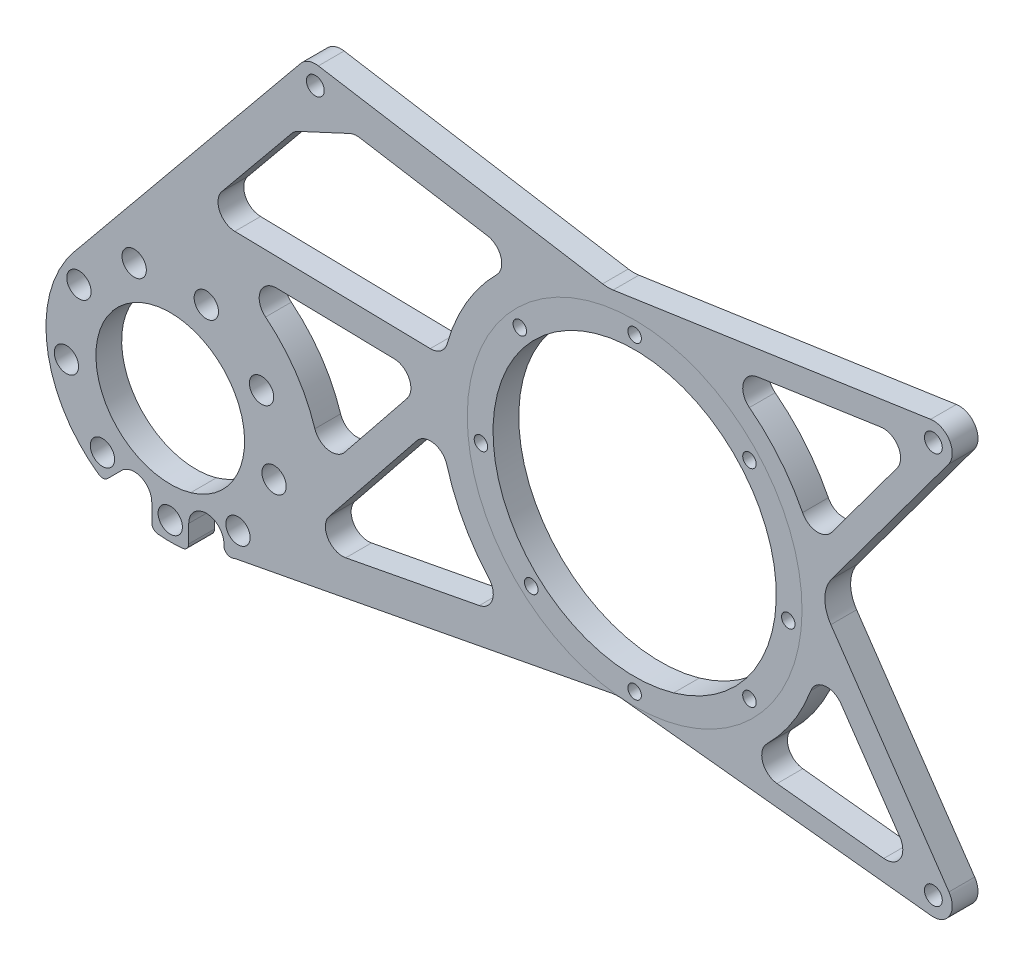
from build123d import *

# Parameters (mm, degrees)
SKETCH15_R          = 4.5
SKETCH15_R_2        = 27.4955
SKETCH15_R_3        = 2.5
SKETCH15_R_4        = 52.3875
SKETCH15_R_5        = 3.3
BOSS_EXTRUDE1_DEPTH = 9.525
PROFILE_DEPTH       = 804.13111067
PROF_FILLET_R       = 12.7
CUT_EXTRUDE2_DEPTH  = 804.13111067
FILLET2_R           = 6.35
CUT_EXTRUDE4_DEPTH  = 804.13111067
FILLET5_R           = 6.35


with BuildPart() as part:
    # Sketch15 → Boss-Extrude1 (new body)
    with BuildSketch(Plane(origin=(0, 0, 0), x_dir=(-1, 0, 0), z_dir=(0, 0, 1))):
        with BuildLine():
            ThreePointArc((-468.520845097, 164.597881552), (-470.201009111, 165.051242365), (-471.778645707, 164.316701751))
            Line((-471.778645707, 164.316701751), (-477.043529325, 159.051818133))
            ThreePointArc((-477.043529325, 159.051818133), (-484.127165713, 157.642795249), (-488.139723403, 163.648012211))
            Line((-488.139723403, 163.648012211), (-488.139723403, 170.220745001))
            ThreePointArc((-488.139723403, 170.220745001), (-488.796888696, 171.925600851), (-490.428332433, 172.748273949))
            ThreePointArc((-490.428332433, 172.748273949), (-494.978508993, 172.974), (-499.528685552, 172.748273949))
            ThreePointArc((-499.528685552, 172.748273949), (-501.160129289, 171.925600851), (-501.817294582, 170.220745001))
            Line((-501.817294582, 170.220745001), (-501.817294582, 163.648012211))
            ThreePointArc((-501.817294582, 163.648012211), (-508.317294582, 157.148012211), (-514.817294582, 163.648012211))
            Line((-514.817294582, 163.648012211), (-514.817294582, 164.225022653))
            ThreePointArc((-514.817294582, 164.225022653), (-516.106794745, 166.435870942), (-518.665995494, 166.401924563))
            Line((-518.665995494, 166.401924563), (-660.126842441, 139.458698233))
            Line((-660.126842441, 139.458698233), (-776.492771968, 151.978917225))
            ThreePointArc((-776.492771968, 151.978917225), (-781.907485254, 150.230614898), (-784.225, 145.034))
            Line((-784.225, 145.034), (-784.225, 0))
            ThreePointArc((-784.225, 0), (-782.179140867, -4.939140867), (-777.24, -6.985))
            Line((-777.24, -6.985), (-548.64, -6.985))
            ThreePointArc((-548.64, -6.985), (-545.651186694, -6.313257481), (-543.237237519, -4.427231931))
            Line((-543.237237519, -4.427231931), (-459.418508663, 97.860764379))
            ThreePointArc((-459.418508663, 97.860764379), (-449.426249212, 133.212914363), (-468.520845097, 164.597881552))
        make_face()
        with Locations((-508.317294582, 90.351987789)):
            Circle(SKETCH15_R, mode=Mode.SUBTRACT)
        with Locations((-481.639723403, 90.351987789)):
            Circle(SKETCH15_R, mode=Mode.SUBTRACT)
        with Locations((-528.75349974, 107.5)):
            Circle(SKETCH15_R, mode=Mode.SUBTRACT)
        with Locations((-461.203518245, 107.5)):
            Circle(SKETCH15_R, mode=Mode.SUBTRACT)
        with Locations((-533.38601136, 133.772278929)):
            Circle(SKETCH15_R, mode=Mode.SUBTRACT)
        with Locations((-494.978508993, 127)):
            Circle(SKETCH15_R_2, mode=Mode.SUBTRACT)
        with Locations((-456.571006625, 133.772278929)):
            Circle(SKETCH15_R, mode=Mode.SUBTRACT)
        with Locations((-520.04722577, 156.875733282)):
            Circle(SKETCH15_R, mode=Mode.SUBTRACT)
        with Locations((-494.978508993, 166)):
            Circle(SKETCH15_R, mode=Mode.SUBTRACT)
        with Locations((-469.909792215, 156.875733282)):
            Circle(SKETCH15_R, mode=Mode.SUBTRACT)
        with Locations((-609.91307368, 83.875279047)):
            Circle(SKETCH15_R_3, mode=Mode.SUBTRACT)
        with Locations((-666.75, 135.051477371)):
            Circle(SKETCH15_R_3, mode=Mode.SUBTRACT)
        with Locations((-666.75, 20.751477371)):
            Circle(SKETCH15_R_3, mode=Mode.SUBTRACT)
        with Locations((-709.220726776, 39.660663218)):
            Circle(SKETCH15_R_3, mode=Mode.SUBTRACT)
        with Locations((-624.279273224, 39.660663218)):
            Circle(SKETCH15_R_3, mode=Mode.SUBTRACT)
        with Locations((-666.75, 77.901477371)):
            Circle(SKETCH15_R_4, mode=Mode.SUBTRACT)
        with Locations((-723.58692632, 83.875279047)):
            Circle(SKETCH15_R_3, mode=Mode.SUBTRACT)
        with Locations((-709.220726776, 116.142291524)):
            Circle(SKETCH15_R_3, mode=Mode.SUBTRACT)
        with Locations((-628.509185847, 120.372204147)):
            Circle(SKETCH15_R_3, mode=Mode.SUBTRACT)
        with Locations((-548.64, 0)):
            Circle(SKETCH15_R_5, mode=Mode.SUBTRACT)
        with Locations((-777.24, 0)):
            Circle(SKETCH15_R_5, mode=Mode.SUBTRACT)
        with Locations((-777.24, 145.034)):
            Circle(SKETCH15_R_5, mode=Mode.SUBTRACT)
    extrude(amount=BOSS_EXTRUDE1_DEPTH)

    # Sketch18 → Profile (cut, through all)
    with BuildSketch(Plane.XY.offset(9.525)):
        with BuildLine():
            Line((656.843849148, -10.682497906), (776.22161066, 6.910362375))
            ThreePointArc((776.22161066, 6.910362375), (776.729439616, 6.966315604), (777.24, 6.985))
            Line((777.24, 6.985), (548.64, 6.985))
            ThreePointArc((548.64, 6.985), (549.207578223, 6.961902036), (549.771402717, 6.892760905))
            Line((549.771402717, 6.892760905), (656.843849148, -10.682497906))
        make_face()
        with BuildLine():
            Line((734.216175486, -69.849260886), (783.003068504, -141.087195416))
            ThreePointArc((783.003068504, -141.087195416), (783.91252795, -142.968183999), (784.225, -145.034))
            Line((784.225, -145.034), (784.225, 0))
            ThreePointArc((784.225, 0), (783.873353099, -2.188344502), (782.853818423, -4.156352694))
            Line((782.853818423, -4.156352694), (734.216175486, -69.849260886))
        make_face()
    extrude(amount=-PROFILE_DEPTH, mode=Mode.SUBTRACT)

    # Prof Fillet
    prof_fillet_edges = [part.edges().sort_by_distance(p)[0] for p in [
        (660.126842441, -139.458698233, 4.7625),
        (734.216175486, -69.849260886, 4.7625),
        (656.843849148, -10.682497906, 4.7625),
    ]]
    fillet(prof_fillet_edges, radius=PROF_FILLET_R)

    # Sketch19 → Cut-Extrude2 (cut, through all)
    with BuildSketch(Plane.XY.offset(9.525)):
        with BuildLine():
            ThreePointArc((694.45302227, -14.12600314), (718.284506978, -31.22211205), (732.946816776, -56.623554423))
            Line((732.946816776, -56.623554423), (772.979141054, -2.553504053))
            Line((772.979141054, -2.553504053), (694.45302227, -14.12600314))
        make_face()
        with BuildLine():
            Line((772.613524345, -143.897556318), (735.318467656, -89.439839453))
            ThreePointArc((735.318467656, -89.439839453), (724.722491105, -116.293648856), (704.133403657, -136.529539656))
            Line((704.133403657, -136.529539656), (772.613524345, -143.897556318))
        make_face()
    extrude(amount=-CUT_EXTRUDE2_DEPTH, mode=Mode.SUBTRACT)

    # Fillet2
    fillet2_edges = [part.edges().sort_by_distance(p)[0] for p in [
        (694.45302227, -14.12600314, 4.7625),
        (772.979141054, -2.553504053, 4.7625),
        (732.946816776, -56.623554423, 4.7625),
        (772.613524345, -143.897556318, 4.7625),
        (704.133403657, -136.529539656, 4.7625),
        (735.318467656, -89.439839453, 4.7625),
    ]]
    fillet(fillet2_edges, radius=FILLET2_R)

    # Sketch22 → Cut-Extrude4 (cut, through all)
    with BuildSketch(Plane.XY.offset(9.525)):
        with BuildLine():
            Line((563.09944586, -8.164904037), (540.883041369, -18.482944043))
            Line((540.883041369, -18.482944043), (505.79558687, -61.301839836))
            Line((505.79558687, -61.301839836), (596.214449629, -63.096701449))
            ThreePointArc((596.214449629, -63.096701449), (606.783495422, -37.920687172), (625.959276135, -18.482944043))
            Line((625.959276135, -18.482944043), (563.09944586, -8.164904037))
        make_face()
        with BuildLine():
            Line((542.982722013, -148.842154434), (621.388723544, -133.908618474))
            ThreePointArc((621.388723544, -133.908618474), (603.082763934, -111.679107661), (594.94086334, -84.057218462))
            Line((594.94086334, -84.057218462), (542.982722013, -148.842154434))
        make_face()
        with BuildLine():
            Line((590.665799743, -73.148559395), (502.723422183, -71.402857307))
            ThreePointArc((502.723422183, -71.402857307), (535.868576594, -88.541862661), (550.94559886, -122.674400877))
            Line((550.94559886, -122.674400877), (590.665799743, -73.148559395))
        make_face()
    extrude(amount=-CUT_EXTRUDE4_DEPTH, mode=Mode.SUBTRACT)

    # Fillet5
    fillet5_edges = [part.edges().sort_by_distance(p)[0] for p in [
        (621.388723544, -133.908618474, 4.7625),
        (542.982722013, -148.842154434, 4.7625),
        (594.94086334, -84.057218462, 4.7625),
        (550.94559886, -122.674400877, 4.7625),
        (590.665799743, -73.148559395, 4.7625),
        (502.723422183, -71.402857307, 4.7625),
        (596.214449629, -63.096701449, 4.7625),
        (505.79558687, -61.301839836, 4.7625),
        (625.959276135, -18.482944043, 4.7625),
        (563.09944586, -8.164904037, 4.7625),
        (540.883041369, -18.482944043, 4.7625),
    ]]
    fillet(fillet5_edges, radius=FILLET5_R)


solid = part.part
